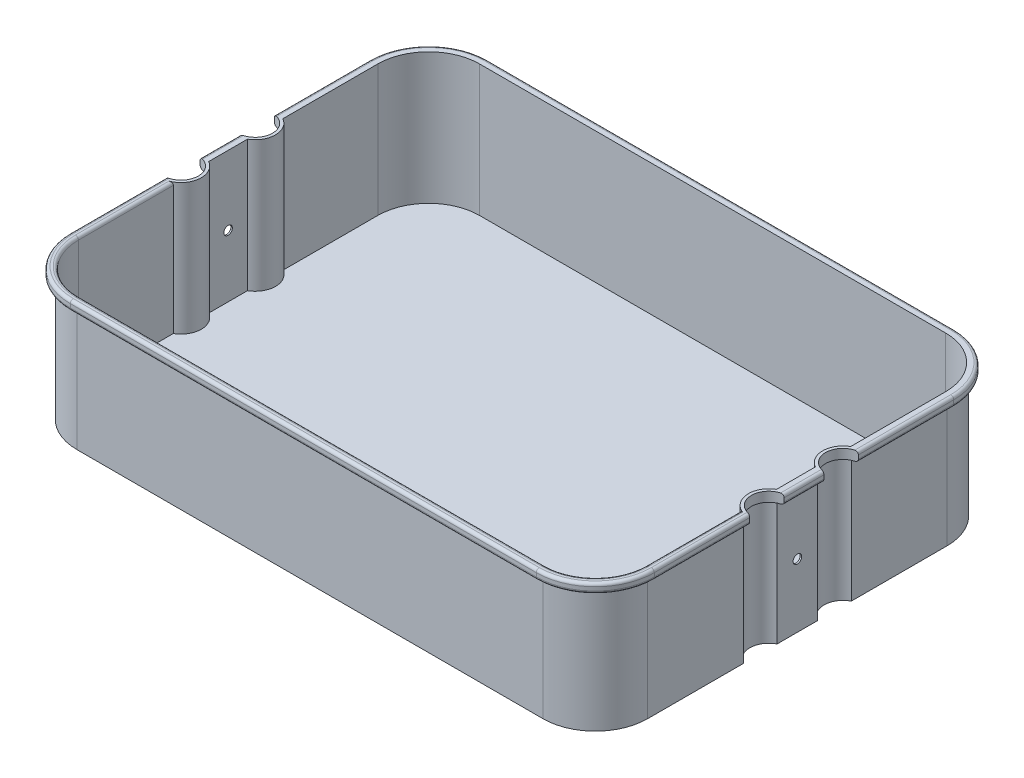
from build123d import *

# Parameters (mm, degrees)
BOSS_EXTRUDE1_DEPTH = 89
SHELL1_T            = 1
BOSS_EXTRUDE2_DEPTH = 6.5
FILLET1_R           = 2
SKETCH3_R           = 2.9
CUT_EXTRUDE1_DEPTH  = 426.904332073


with BuildPart() as part:
    # Sketch1 → Boss-Extrude1 (new body)
    with BuildSketch(Plane(origin=(0, 0, 0), x_dir=(1, 0, 0), z_dir=(0, 1, 0))):
        with BuildLine():
            Line((-192.5, -37.129148551), (-192.5, -101.5))
            ThreePointArc((-192.5, -101.5), (-182.395183951, -125.895183951), (-158, -136))
            Line((-158, -136), (158, -136))
            ThreePointArc((158, -136), (182.395183951, -125.895183951), (192.5, -101.5))
            Line((192.5, -101.5), (192.5, -37.129148551))
            ThreePointArc((192.5, -37.129148551), (185.5, -25.15), (192.5, -13.170851449))
            Line((192.5, -13.170851449), (192.5, 13.170851449))
            ThreePointArc((192.5, 13.170851449), (185.5, 25.15), (192.5, 37.129148551))
            Line((192.5, 37.129148551), (192.5, 101.5))
            ThreePointArc((192.5, 101.5), (182.395183951, 125.895183951), (158, 136))
            Line((158, 136), (-158, 136))
            ThreePointArc((-158, 136), (-182.395183951, 125.895183951), (-192.5, 101.5))
            Line((-192.5, 101.5), (-192.5, 37.129148551))
            ThreePointArc((-192.5, 37.129148551), (-185.5, 25.15), (-192.5, 13.170851449))
            Line((-192.5, 13.170851449), (-192.5, -13.170851449))
            ThreePointArc((-192.5, -13.170851449), (-185.5, -25.15), (-192.5, -37.129148551))
        make_face()
    extrude(amount=-BOSS_EXTRUDE1_DEPTH)

    # Shell1
    shell1_openings = [part.faces().sort_by_distance(p)[0] for p in [
        (0, 0, 0),
    ]]
    offset(amount=SHELL1_T, openings=shell1_openings, kind=Kind.INTERSECTION)

    # Sketch2 → Boss-Extrude2 (add)
    with BuildSketch(Plane(origin=(0, 0, 0), x_dir=(1, 0, 0), z_dir=(0, 1, 0))):
        with BuildLine():
            Line((-198, -36.833321446), (-198, -101.5))
            ThreePointArc((-198, -101.5), (-186.284271247, -129.784271247), (-158, -141.5))
            Line((-158, -141.5), (158, -141.5))
            ThreePointArc((158, -141.5), (186.284271247, -129.784271247), (198, -101.5))
            Line((198, -101.5), (198, -36.833321446))
            ThreePointArc((198, -36.833321446), (187.5, -25.15), (198, -13.466678554))
            Line((198, -13.466678554), (198, 13.466678554))
            ThreePointArc((198, 13.466678554), (187.5, 25.15), (198, 36.833321446))
            Line((198, 36.833321446), (198, 101.5))
            ThreePointArc((198, 101.5), (186.284271247, 129.784271247), (158, 141.5))
            Line((158, 141.5), (-158, 141.5))
            ThreePointArc((-158, 141.5), (-186.284271247, 129.784271247), (-198, 101.5))
            Line((-198, 101.5), (-198, 36.833321446))
            ThreePointArc((-198, 36.833321446), (-190.510720854, 33.004139036), (-187.5, 25.15))
            ThreePointArc((-187.5, 25.15), (-190.510720854, 17.295860964), (-198, 13.466678554))
            Line((-198, 13.466678554), (-198, -13.466678554))
            ThreePointArc((-198, -13.466678554), (-190.510720854, -17.295860964), (-187.5, -25.15))
            ThreePointArc((-187.5, -25.15), (-190.510720854, -33.004139036), (-198, -36.833321446))
        make_face()
        with BuildLine():
            ThreePointArc((-193.5, 13.770193323), (-186.5, 25.15), (-193.5, 36.529806677))
            Line((-193.5, 36.529806677), (-193.5, 101.5))
            ThreePointArc((-193.5, 101.5), (-183.102290732, 126.602290732), (-158, 137))
            Line((-158, 137), (158, 137))
            ThreePointArc((158, 137), (183.102290732, 126.602290732), (193.5, 101.5))
            Line((193.5, 101.5), (193.5, 36.529806677))
            ThreePointArc((193.5, 36.529806677), (186.5, 25.15), (193.5, 13.770193323))
            Line((193.5, 13.770193323), (193.5, -13.770193323))
            ThreePointArc((193.5, -13.770193323), (186.5, -25.15), (193.5, -36.529806677))
            Line((193.5, -36.529806677), (193.5, -101.5))
            ThreePointArc((193.5, -101.5), (183.102290732, -126.602290732), (158, -137))
            Line((158, -137), (-158, -137))
            ThreePointArc((-158, -137), (-183.102290732, -126.602290732), (-193.5, -101.5))
            Line((-193.5, -101.5), (-193.5, -36.529806677))
            ThreePointArc((-193.5, -36.529806677), (-186.5, -25.15), (-193.5, -13.770193323))
            Line((-193.5, -13.770193323), (-193.5, 13.770193323))
        make_face(mode=Mode.SUBTRACT)
    extrude(amount=-BOSS_EXTRUDE2_DEPTH)

    # Fillet1
    fillet1_edges = [part.edges().sort_by_distance(p)[0] for p in [
        (198, -6.5, 0),
        (198, -6.5, 69.166660723),
        (186.284271247, -6.5, 129.784271247),
        (0, -6.5, 141.5),
        (-186.284271247, -6.5, 129.784271247),
        (-198, 0, 69.166660723),
        (-198, 0, 0),
        (-198, 0, -69.166660723),
        (-186.284271247, -6.5, -129.784271247),
        (0, 0, -141.5),
        (186.284271247, -6.5, -129.784271247),
        (198, -6.5, -69.166660723),
        (-198, -6.5, 69.166660723),
        (-198, -6.5, 0),
        (-198, -6.5, -69.166660723),
        (0, -6.5, -141.5),
        (198, 0, -69.166660723),
        (186.284271247, 0, -129.784271247),
        (-186.284271247, 0, -129.784271247),
        (-186.284271247, 0, 129.784271247),
        (0, 0, 141.5),
        (186.284271247, 0, 129.784271247),
        (198, 0, 69.166660723),
        (198, 0, 0),
        (-182.395183951, 0, 125.895183951),
        (-192.5, 0, 69.314574275),
        (0, 0, 136),
        (182.395183951, 0, 125.895183951),
        (192.5, 0, 69.314574275),
    ]]
    fillet(fillet1_edges, radius=FILLET1_R)

    # Sketch3 → Cut-Extrude1 (cut, through all)
    with BuildSketch(Plane.ZY.offset(193.5)):
        with Locations(Location((0, -47, 0), (0, 0, 180))):
            Circle(SKETCH3_R)
    extrude(amount=-CUT_EXTRUDE1_DEPTH, mode=Mode.SUBTRACT)


solid = part.part
